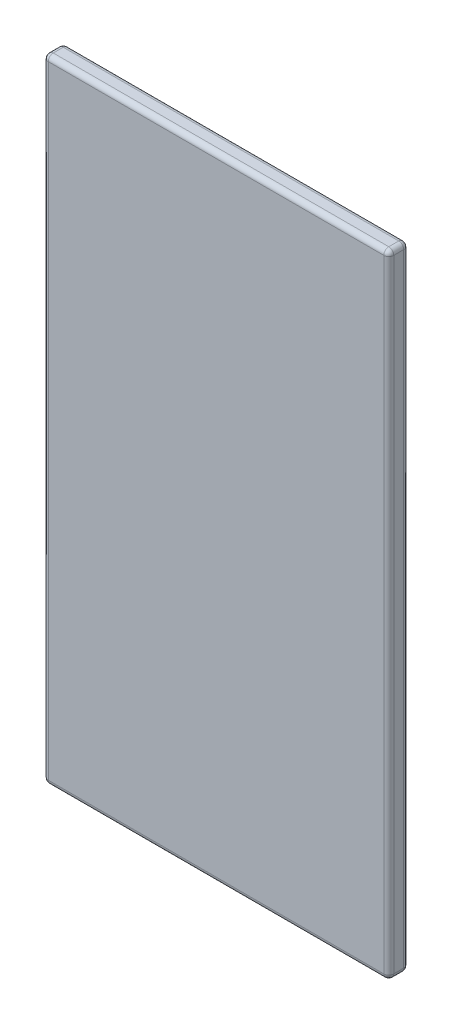
from build123d import *

# Parameters (mm, degrees)
SKETCH1_W           = 34.7
SKETCH1_H           = 63.5
BOSS_EXTRUDE1_DEPTH = 2
FILLET1_R           = 0.5


with BuildPart() as part:
    # Sketch1 → Boss-Extrude1 (new body)
    with BuildSketch(Plane.XY):
        Rectangle(SKETCH1_W, SKETCH1_H)
    extrude(amount=BOSS_EXTRUDE1_DEPTH)

    # Fillet1
    fillet1_edges = [part.edges().sort_by_distance(p)[0] for p in [
        (-17.35, 0, 2),
        (0, -31.75, 2),
        (17.35, 0, 2),
        (0, -31.75, 0),
        (-17.35, 0, 0),
        (0, 31.75, 0),
        (17.35, 0, 0),
        (17.35, -31.75, 1),
        (-17.35, -31.75, 1),
        (-17.35, 31.75, 1),
        (17.35, 31.75, 1),
        (0, 31.75, 2),
    ]]
    fillet(fillet1_edges, radius=FILLET1_R)


solid = part.part
